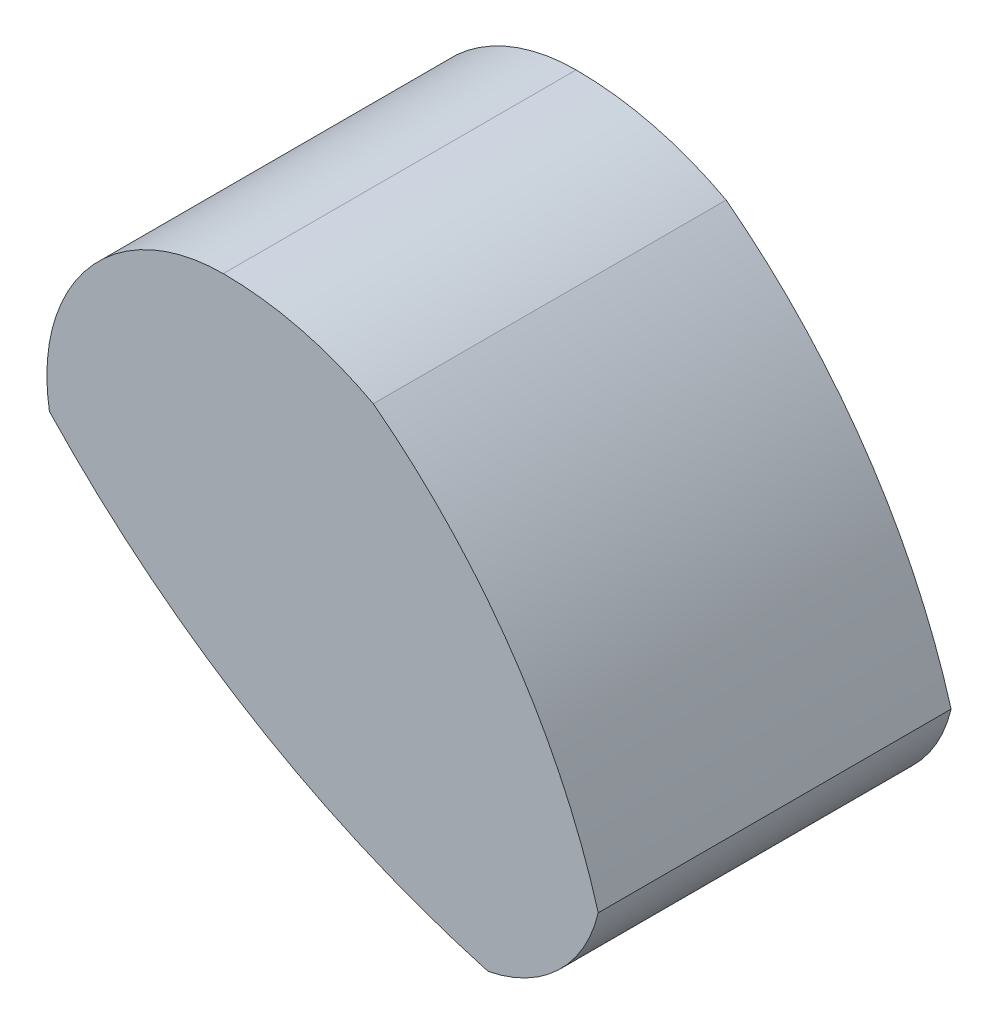
from build123d import *

# Parameters (mm, degrees)
BOSS_EXTRUDE3_DEPTH      = 10
M3_CLEARANCE_HOLE1_D     = 3.6
M3_CLEARANCE_HOLE1_DEPTH = 5.5
M3_CLEARANCE_HOLE1_TIP   = 1.081549114


with BuildPart() as part:
    # Sketch3 → Boss-Extrude3 (new body)
    with BuildSketch(Plane.XY):
        with BuildLine():
            ThreePointArc((10.627637959, -5.374147741), (8.187588203, -0.208463055), (4.251688797, 3.93241088))
            ThreePointArc((4.251688797, 3.93241088), (2.191837366, 4.729023368), (0, 5))
            ThreePointArc((0, 5), (-3.823420235, 3.222026956), (-4.927665225, -0.847416917))
            ThreePointArc((-4.927665225, -0.847416917), (0.77252532, -5.462986054), (7.504596942, -8.374147741))
            ThreePointArc((7.504596942, -8.374147741), (9.507210052, -7.33333117), (10.627637959, -5.374147741))
        make_face()
    extrude(amount=BOSS_EXTRUDE3_DEPTH)

    # M3 Clearance Hole1
    with Locations(Plane(origin=(0, 0, 0), x_dir=(-1, 0, 0), z_dir=(0, 0, -1))):
        with Locations((0, 2)):
            Hole(M3_CLEARANCE_HOLE1_D / 2, depth=M3_CLEARANCE_HOLE1_DEPTH)
            with Locations((0, 0, -(M3_CLEARANCE_HOLE1_DEPTH + M3_CLEARANCE_HOLE1_TIP / 2))):  # 118° drill point
                Cone(0, M3_CLEARANCE_HOLE1_D / 2, M3_CLEARANCE_HOLE1_TIP, mode=Mode.SUBTRACT)


solid = part.part
